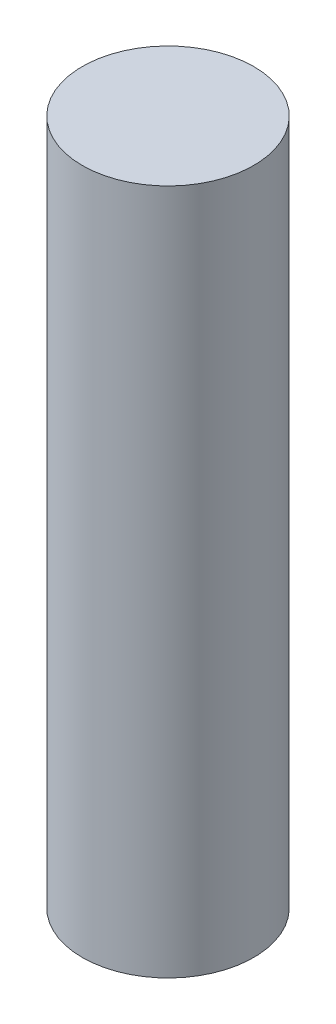
from build123d import *

# Parameters (mm, degrees)
SZKIC1_R                    = 0.25
DODANIE_WYCI_GNI_CIE1_DEPTH = 2


with BuildPart() as part:
    # Szkic1 → Dodanie-wyciągnięcie1 (new body)
    with BuildSketch(Plane(origin=(0, 0, 0), x_dir=(1, 0, 0), z_dir=(0, 1, 0))):
        with Locations(Location((0, 0, 0), (0, 0, 270))):
            Circle(SZKIC1_R)
    extrude(amount=DODANIE_WYCI_GNI_CIE1_DEPTH)


solid = part.part
